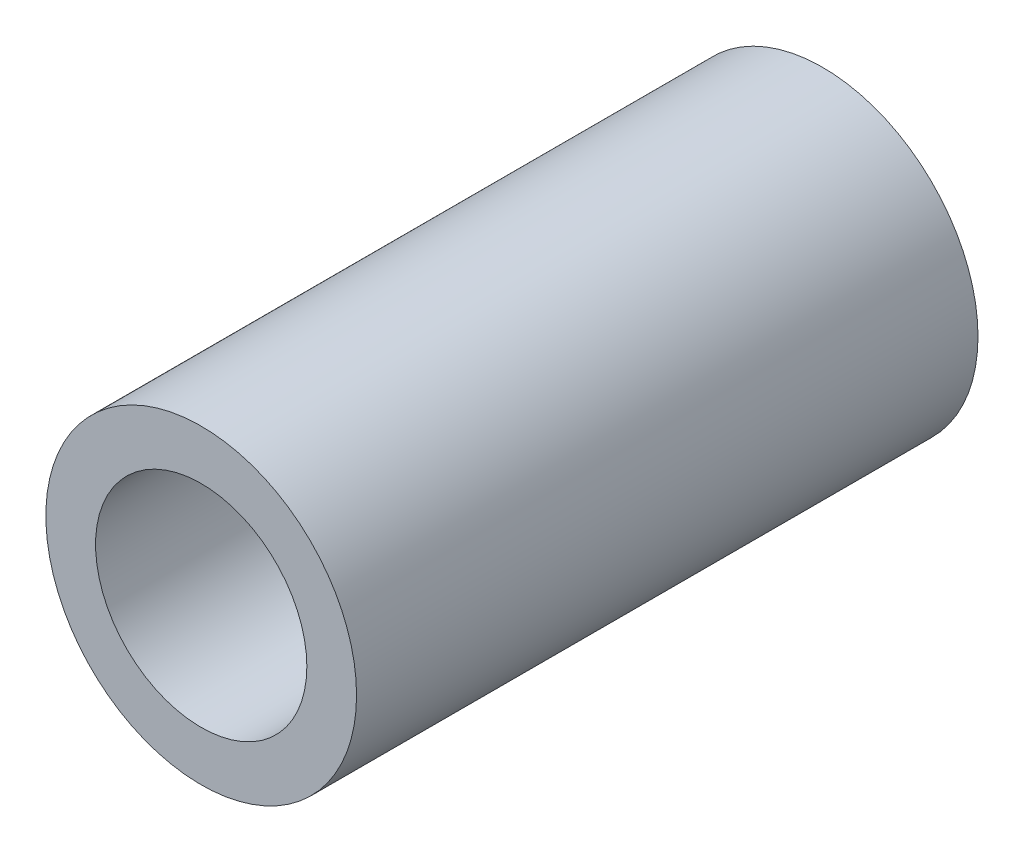
from build123d import *

# Parameters (mm, degrees)
SKETCH1_R            = 2.5
BOSS_EXTRUDE1_DEPTH  = 10
M3_CLEARANCE_HOLE1_D = 3.4


with BuildPart() as part:
    # Sketch1 → Boss-Extrude1 (new body)
    with BuildSketch(Plane.XY):
        Circle(SKETCH1_R)
    extrude(amount=BOSS_EXTRUDE1_DEPTH)

    # M3 Clearance Hole1 (through all)
    with Locations(Plane.XY.offset(10)):
        with Locations((0, 0)):
            Hole(M3_CLEARANCE_HOLE1_D / 2)


solid = part.part
